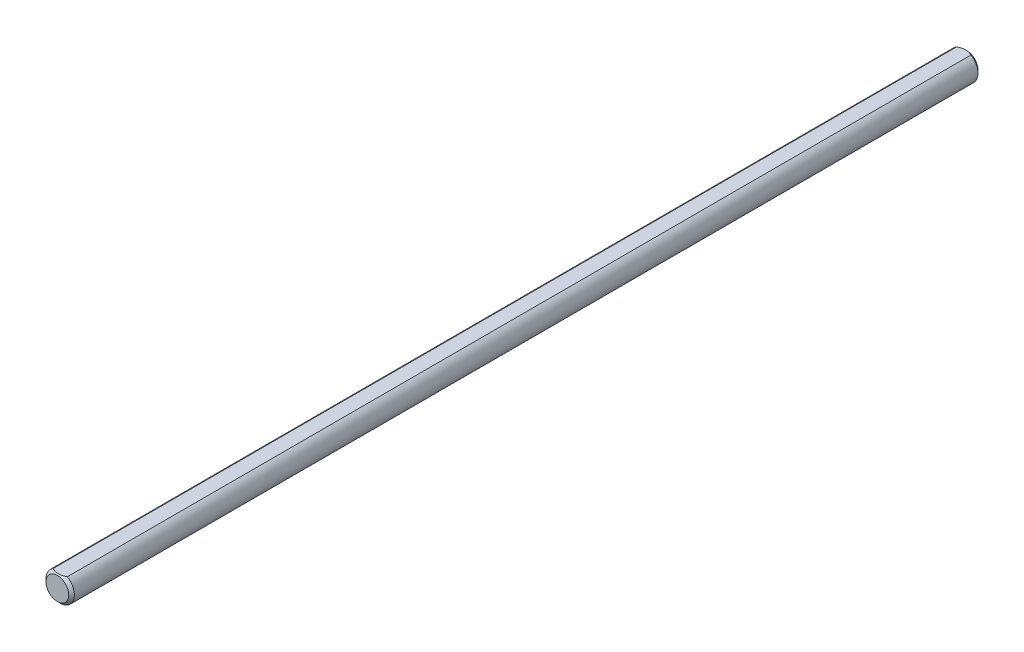
from build123d import *

# Parameters (mm, degrees)
SKETCH1_R           = 3.175
EXTRUDE1_DEPTH      = 101.6
CHAMFER1_SIZE       = 0.635
EXTRUDE7_DEPTH      = 102.699170351
EXTRUDE7_DEPTH_BACK = 102.699170351


with BuildPart() as part:
    # Sketch1 → Extrude1 (new, symmetric)
    with BuildSketch(Plane.XY):
        Circle(SKETCH1_R)
    extrude(amount=EXTRUDE1_DEPTH, both=True)

    # Chamfer1
    chamfer1_edges = [part.edges().sort_by_distance(p)[0] for p in [
        (-3.175, 0, -101.6),
        (-3.175, 0, 101.6),
    ]]
    chamfer(chamfer1_edges, length=CHAMFER1_SIZE)

    # Sketch13 → Extrude7 (cut, two sides: drawn at the far end of the back side and taken through both)
    with BuildSketch(Plane.XY.offset(-EXTRUDE7_DEPTH_BACK)):
        with BuildLine():
            Line((-1.5875, 2.749630657), (1.5875, 2.749630657))
            ThreePointArc((1.5875, 2.749630657), (0, 3.175), (-1.5875, 2.749630657))
        make_face()
    extrude(amount=EXTRUDE7_DEPTH + EXTRUDE7_DEPTH_BACK, mode=Mode.SUBTRACT)


solid = part.part
